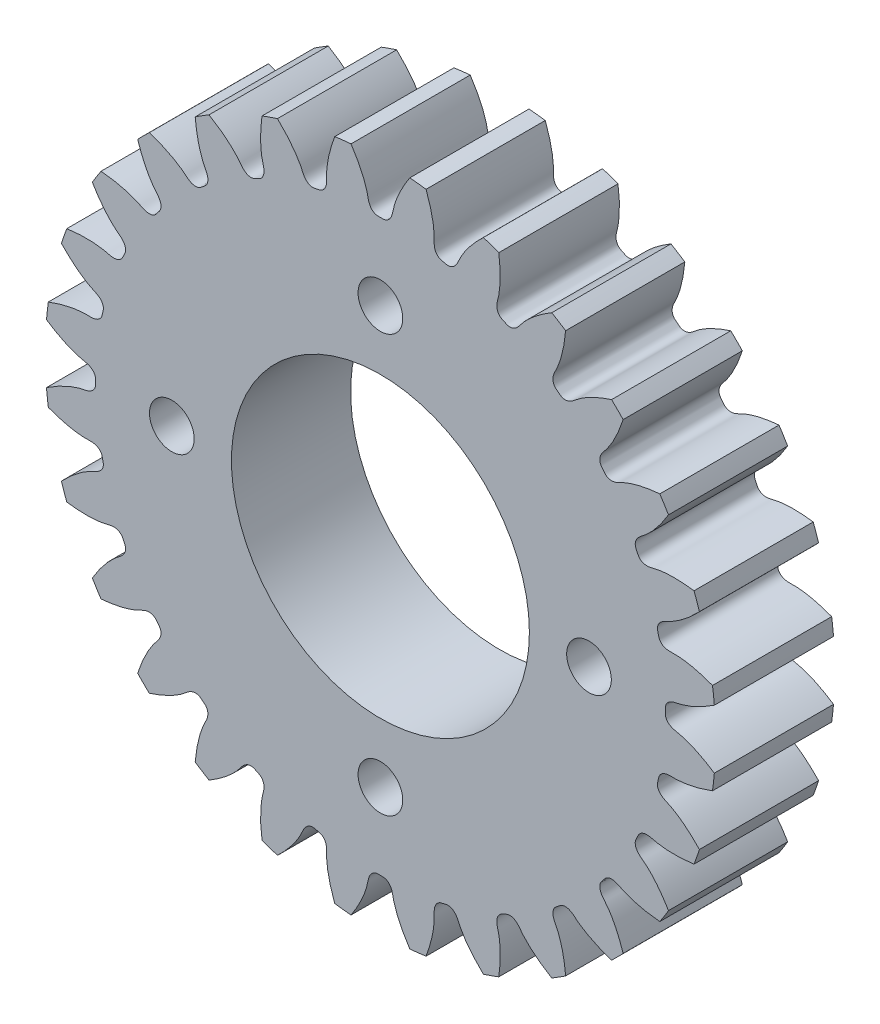
from build123d import *

# Parameters (mm, degrees)
SKETCHREVOLVESPURASSEMBLY01GEAR_W       = 8
SKETCHREVOLVESPURASSEMBLY01GEAR_H       = 22.499999662
TOOTHEXTRUDECUTSPURASSEMBLY01GEAR_DEPTH = 4
PATTERNSPURASSEMBLY01GEAR_COUNT         = 28
BOREREVOLVESKETCH_W                     = 8
BOREREVOLVESKETCH_H                     = 10
SKETCH1_R                               = 1.5
CUT_EXTRUDE1_DEPTH                      = 33.691116667
CIRPATTERN1_COUNT                       = 4


with BuildPart() as part:
    # SketchRevolveSpurAssembly01Gear → SpurAssembly01Gear (revolve)
    with BuildSketch(Plane(origin=(0, 0, 0), x_dir=(0, 0, -1), z_dir=(1, 0, 0))):
        with Locations((0, 11.249999831)):
            Rectangle(SKETCHREVOLVESPURASSEMBLY01GEAR_W, SKETCHREVOLVESPURASSEMBLY01GEAR_H)
    revolve(axis=Axis((0, 0, 0), (0, 0, -1)))

    # SketchToothSpurAssembly01Gear → ToothExtrudeCutSpurAssembly01Gear (cut, symmetric)
    with BuildSketch(Plane.XY):
        with BuildLine():
            ThreePointArc((22.484304648, 2.021547473), (22.574999661, 0), (22.484304648, -2.021547473))
            add(Edge.make_bspline(
                [(22.484304648, -2.021547473), (22.442838604, -1.99337238), (22.380745188, -1.951800929), (22.297909948, -1.897591839), (22.236702797, -1.858141014), (22.176026796, -1.819626347), (22.115891956, -1.782038532), (22.056308186, -1.74536817), (21.99728529, -1.70960577), (21.938832967, -1.674741749), (21.880960809, -1.640766431), (21.823678301, -1.607670054), (21.766994822, -1.575442765), (21.710919639, -1.544074624), (21.655461913, -1.513555605), (21.600630694, -1.483875596), (21.546434919, -1.4550244), (21.492883416, -1.426991737), (21.4399849, -1.399767246), (21.387747974, -1.373340482), (21.336181124, -1.347700923), (21.285292725, -1.322837965), (21.235091035, -1.298740927), (21.185584198, -1.275399052), (21.13678024, -1.252801505), (21.088687069, -1.230937379), (21.041312479, -1.209795691), (20.994664141, -1.189365386), (20.948749611, -1.169635338), (20.903576322, -1.150594351), (20.859151589, -1.132231159), (20.815482605, -1.114534427), (20.772576442, -1.097492757), (20.730440051, -1.08109468), (20.689080259, -1.065328666), (20.648503769, -1.05018312), (20.608717162, -1.035646385), (20.569726896, -1.021706743), (20.5315393, -1.008352416), (20.494160581, -0.995571567), (20.45759682, -0.983352301), (20.42185397, -0.971682667), (20.38693786, -0.960550658), (20.352854188, -0.949944215), (20.319608528, -0.939851222), (20.287206323, -0.930259516), (20.255652888, -0.92115688), (20.22495341, -0.912531049), (20.195112946, -0.90436971), (20.166136422, -0.896660503), (20.138028636, -0.88939102), (20.110794252, -0.882548813), (20.084437806, -0.876121388), (20.058963701, -0.870096203), (20.034376206, -0.864460704), (20.01067947, -0.8592022), (19.987877463, -0.854308292), (19.965974191, -0.849765394), (19.944972927, -0.845563912), (19.924878911, -0.841680138), (19.87227339, -0.831973311), (19.811866584, -0.821152968), (19.74457609, -0.804763591), (19.702789292, -0.793428399), (19.661927102, -0.78101044), (19.621905325, -0.76745415), (19.582636214, -0.752643706), (19.544021303, -0.736438261), (19.505955464, -0.718651649), (19.468330826, -0.69904403), (19.431045422, -0.677307547), (19.394018155, -0.653051261), (19.35721382, -0.625785914), (19.32068265, -0.594913176), (19.284619122, -0.559727874), (19.249442098, -0.519448336), (19.215889916, -0.473296475), (19.185104384, -0.420653027), (19.158653823, -0.361290347), (19.138407105, -0.295671006), (19.126960558, -0.229173052), (19.1221406, -0.130028953), (19.127083253, 0), (19.1221406, 0.130028953), (19.126960558, 0.229173052), (19.138407105, 0.295671006), (19.158653823, 0.361290347), (19.185104384, 0.420653027), (19.215889916, 0.473296475), (19.249442098, 0.519448336), (19.284619122, 0.559727874), (19.32068265, 0.594913176), (19.35721382, 0.625785914), (19.394018155, 0.653051261), (19.431045422, 0.677307547), (19.468330826, 0.69904403), (19.505955464, 0.718651649), (19.544021303, 0.736438261), (19.582636214, 0.752643706), (19.621905325, 0.76745415), (19.661927102, 0.78101044), (19.702789292, 0.793428399), (19.74457609, 0.804763591), (19.811866584, 0.821152968), (19.87227339, 0.831973311), (19.924878911, 0.841680138), (19.944972927, 0.845563912), (19.965974191, 0.849765394), (19.987877463, 0.854308292), (20.01067947, 0.8592022), (20.034376206, 0.864460704), (20.058963701, 0.870096203), (20.084437806, 0.876121388), (20.110794252, 0.882548813), (20.138028636, 0.88939102), (20.166136422, 0.896660503), (20.195112946, 0.90436971), (20.22495341, 0.912531049), (20.255652888, 0.92115688), (20.287206323, 0.930259516), (20.319608528, 0.939851222), (20.352854188, 0.949944215), (20.38693786, 0.960550658), (20.42185397, 0.971682667), (20.45759682, 0.983352301), (20.494160581, 0.995571567), (20.5315393, 1.008352416), (20.569726896, 1.021706743), (20.608717162, 1.035646385), (20.648503769, 1.05018312), (20.689080259, 1.065328666), (20.730440051, 1.08109468), (20.772576442, 1.097492757), (20.815482605, 1.114534427), (20.859151589, 1.132231159), (20.903576322, 1.150594351), (20.948749611, 1.169635338), (20.994664141, 1.189365386), (21.041312479, 1.209795691), (21.088687069, 1.230937379), (21.13678024, 1.252801505), (21.185584198, 1.275399052), (21.235091035, 1.298740927), (21.285292725, 1.322837965), (21.336181124, 1.347700923), (21.387747974, 1.373340482), (21.4399849, 1.399767246), (21.492883416, 1.426991737), (21.546434919, 1.4550244), (21.600630694, 1.483875596), (21.655461913, 1.513555605), (21.710919639, 1.544074624), (21.766994822, 1.575442765), (21.823678301, 1.607670054), (21.880960809, 1.640766431), (21.938832967, 1.674741749), (21.99728529, 1.70960577), (22.056308186, 1.74536817), (22.115891956, 1.782038532), (22.176026796, 1.819626347), (22.236702797, 1.858141014), (22.297909948, 1.897591839), (22.380745188, 1.951800929), (22.442838604, 1.99337238), (22.484304648, 2.021547473)],
                knots=[0, 0, 0, 0, 0.018125839, 0.027016678, 0.035792797, 0.044454195, 0.053000872, 0.061432829, 0.069750065, 0.077952581, 0.086040376, 0.094013451, 0.101871806, 0.10961544, 0.117244353, 0.124758546, 0.132158018, 0.13944277, 0.146612802, 0.153668112, 0.160608703, 0.167434573, 0.174145722, 0.180742151, 0.187223859, 0.193590847, 0.199843114, 0.205980661, 0.212003488, 0.217911594, 0.223704979, 0.229383644, 0.234947588, 0.240396812, 0.245731315, 0.250951098, 0.25605616, 0.261046502, 0.265922124, 0.270683024, 0.275329205, 0.279860665, 0.284277404, 0.288579423, 0.292766721, 0.296839299, 0.300797156, 0.304640293, 0.308368709, 0.311982405, 0.31548138, 0.318865635, 0.32213517, 0.325289983, 0.328330077, 0.33125545, 0.334066102, 0.336762034, 0.339343245, 0.341809736, 0.344161506, 0.35868499, 0.363984246, 0.369197096, 0.374337756, 0.379422915, 0.384472236, 0.389508934, 0.394560463, 0.399659285, 0.404843682, 0.410158512, 0.41565572, 0.421394227, 0.427438579, 0.43385544, 0.440706731, 0.448038372, 0.455864754, 0.464151763, 0.472805007, 0.480182006, 0.5, 0.519817994, 0.527194993, 0.535848237, 0.544135246, 0.551961628, 0.559293269, 0.56614456, 0.572561421, 0.578605773, 0.58434428, 0.589841488, 0.595156318, 0.600340715, 0.605439537, 0.610491066, 0.615527764, 0.620577085, 0.625662244, 0.630802904, 0.636015754, 0.64131501, 0.655838494, 0.658190264, 0.660656755, 0.663237966, 0.665933898, 0.66874455, 0.671669923, 0.674710017, 0.67786483, 0.681134365, 0.68451862, 0.688017595, 0.691631291, 0.695359707, 0.699202844, 0.703160701, 0.707233279, 0.711420577, 0.715722596, 0.720139335, 0.724670795, 0.729316976, 0.734077876, 0.738953498, 0.74394384, 0.749048902, 0.754268685, 0.759603188, 0.765052412, 0.770616356, 0.776295021, 0.782088406, 0.787996512, 0.794019339, 0.800156886, 0.806409153, 0.812776141, 0.819257849, 0.825854278, 0.832565427, 0.839391297, 0.846331888, 0.853387198, 0.86055723, 0.867841982, 0.875241454, 0.882755647, 0.89038456, 0.898128194, 0.905986549, 0.913959624, 0.922047419, 0.930249935, 0.938567171, 0.946999128, 0.955545805, 0.964207203, 0.972983322, 0.981874161, 1, 1, 1, 1], degree=3))
        make_face()
    toothextrudecutspurassembly01gear = extrude(amount=TOOTHEXTRUDECUTSPURASSEMBLY01GEAR_DEPTH, both=True, mode=Mode.SUBTRACT)

    # PatternSpurAssembly01Gear: ToothExtrudeCutSpurAssembly01Gear ×28 about axis
    patternspurassembly01gear_axis = Axis((0, 0, 4.4), (0, 0, -1))
    for i in range(1, PATTERNSPURASSEMBLY01GEAR_COUNT):
        add(toothextrudecutspurassembly01gear.rotate(patternspurassembly01gear_axis, i * 360 / PATTERNSPURASSEMBLY01GEAR_COUNT), mode=Mode.SUBTRACT)

    # BoreRevolveSketch → BoreRevolveCut (revolve, cut)
    with BuildSketch(Plane(origin=(0, 0, 0), x_dir=(0, 0, -1), z_dir=(1, 0, 0))):
        with Locations((0, 5)):
            Rectangle(BOREREVOLVESKETCH_W, BOREREVOLVESKETCH_H)
    revolve(axis=Axis((0, 0, 0), (0, 0, -1)), mode=Mode.SUBTRACT)

    # Sketch1 → Cut-Extrude1 (cut, through all)
    with BuildSketch(Plane.XY.offset(4)):
        with Locations((-14, 0)):
            Circle(SKETCH1_R)
    cut_extrude1 = extrude(amount=-CUT_EXTRUDE1_DEPTH, mode=Mode.SUBTRACT)

    # CirPattern1: Cut-Extrude1 ×4 about axis
    cirpattern1_axis = Axis((0, 0, 0), (0, 0, 1))
    for i in range(1, CIRPATTERN1_COUNT):
        add(cut_extrude1.rotate(cirpattern1_axis, i * 360 / CIRPATTERN1_COUNT), mode=Mode.SUBTRACT)


solid = part.part
